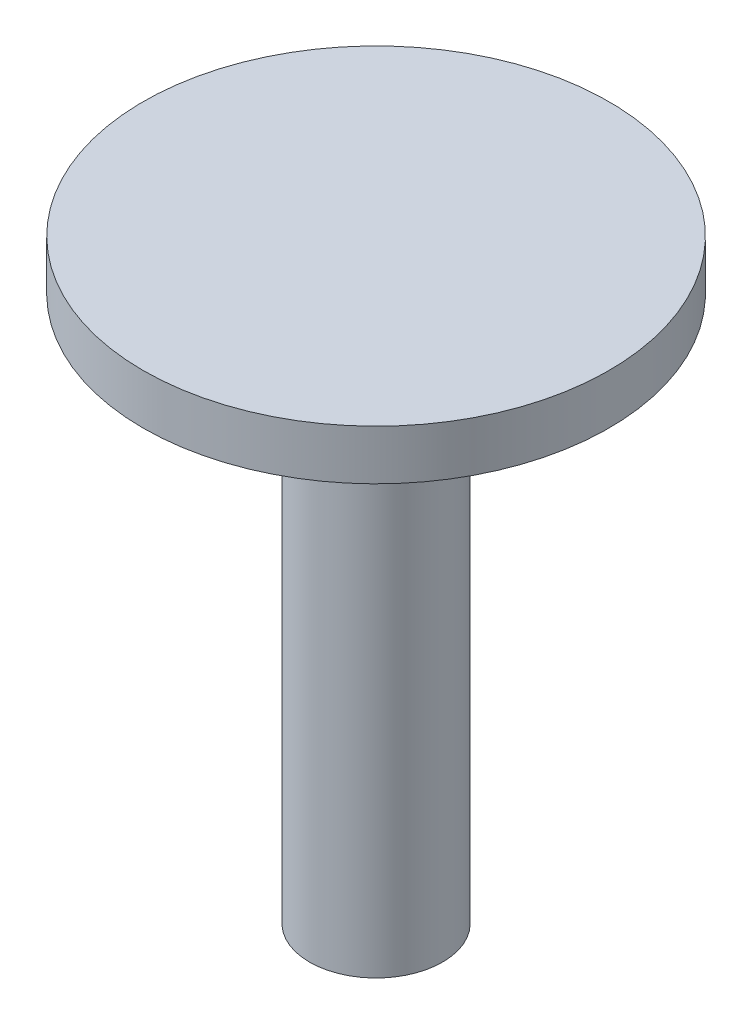
from build123d import *


with BuildPart() as part:
    # Schizzo1 → Rivoluzione1 (revolve)
    with BuildSketch(Plane.XY, mode=Mode.PRIVATE) as rivoluzione1_sk:
        Polygon((-4, 0), (-4, 32.8), (-14, 32.8), (-14, 35.8), (0, 35.8), (0, 0), align=None)
    revolve(rivoluzione1_sk.sketch.rotate(Axis((0, 0, 0), (0, -1, 0)), 270), axis=Axis((0, 0, 0), (0, -1, 0)))


solid = part.part
